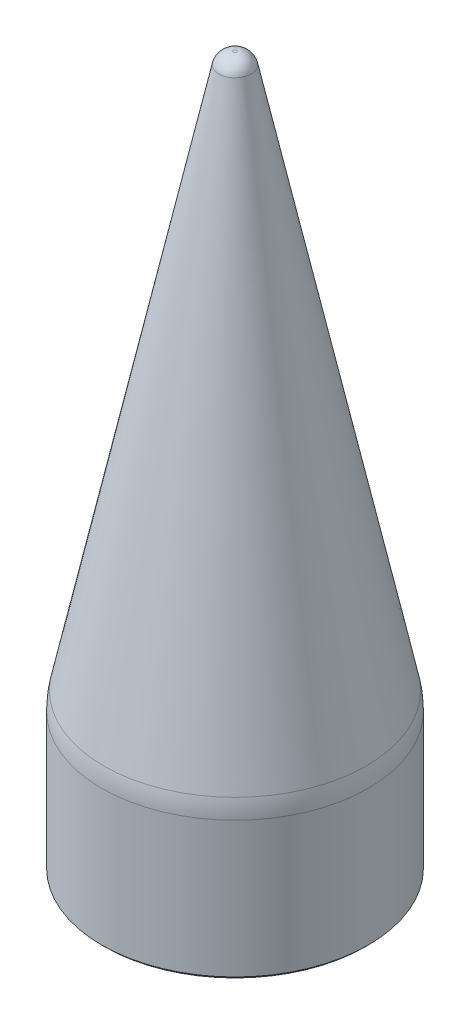
from build123d import *

# Parameters (mm, degrees)
SKETCH_1_R          = 45
EXTRUDE_1_DEPTH     = 50
SKETCH_2_R          = 37.5
CUT_EXTRUDE_1_DEPTH = 50
SKETCH_3_R          = 7.5
EXTRUDE_2_DEPTH     = 80
SKETCH_4_R          = 45
EXTRUDE_3_DEPTH     = 190
EXTRUDE_3_TAPER     = 12
FILLET_1_R          = 5
FILLET_2_R          = 30
CHAMFER_1_SIZE      = 1


with BuildPart() as part:
    # 草图1 → 凸台-拉伸1 (new body)
    with BuildSketch(Plane(origin=(0, 0, 0), x_dir=(1, 0, 0), z_dir=(0, 1, 0))):
        with Locations(Location((0, 0, 0), (0, 0, 270))):
            Circle(SKETCH_1_R)
    extrude(amount=EXTRUDE_1_DEPTH)

    # 草图2 → 切除-拉伸1 (cut)
    with BuildSketch(Plane(origin=(0, 0, 0), x_dir=(-1, 0, 0), z_dir=(0, -1, 0))):
        with Locations(Location((0, 0, 0), (0, 0, 90))):
            Circle(SKETCH_2_R)
    extrude(amount=-CUT_EXTRUDE_1_DEPTH, mode=Mode.SUBTRACT)

    # 草图3 → 凸台-拉伸2 (add)
    with BuildSketch(Plane.XY.offset(40)):
        with Locations((0, 25)):
            Circle(SKETCH_3_R)
    extrude(amount=-EXTRUDE_2_DEPTH)

    # 草图4 → 凸台-拉伸3 (add)
    with BuildSketch(Plane(origin=(0, 50, 0), x_dir=(1, 0, 0), z_dir=(0, 1, 0))):
        with Locations(Location((0, 0, 0), (0, 0, 270))):
            Circle(SKETCH_4_R)
    extrude(amount=EXTRUDE_3_DEPTH, taper=EXTRUDE_3_TAPER)

    # 圆角1
    fillet_1_edges = [part.edges().sort_by_distance(p)[0] for p in [
        (0, 240, -4.614253283),
    ]]
    fillet(fillet_1_edges, radius=FILLET_1_R)

    # 圆角2
    fillet_2_edges = [part.edges().sort_by_distance(p)[0] for p in [
        (0, 50, -45),
    ]]
    fillet(fillet_2_edges, radius=FILLET_2_R)

    # 倒角1
    chamfer_1_edges = [part.edges().sort_by_distance(p)[0] for p in [
        (0, 0, -45),
        (0, 0, 37.5),
    ]]
    chamfer(chamfer_1_edges, length=CHAMFER_1_SIZE)


solid = part.part
